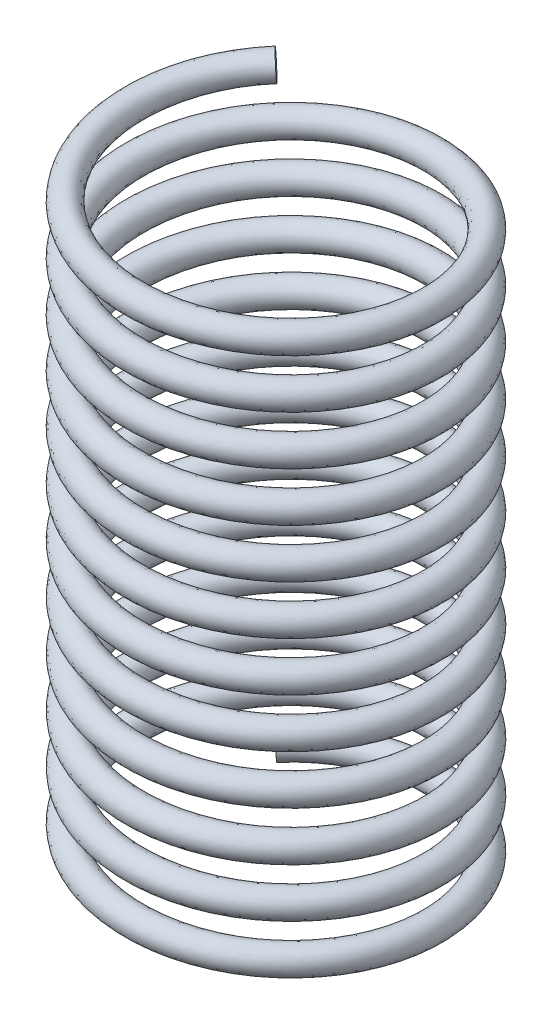
from build123d import *

# Parameters (mm, degrees)
SWEEP2_PITCH       = 1.1
SWEEP2_HEIGHT      = 13.2
SWEEP2_RADIUS      = 3.35
SWEEP2_START_ANGLE = -135
SWEEP2_PROFILE_R   = 0.3


with BuildPart() as part:
    # Sweep2: sweep along a helix
    with BuildLine() as sweep2_path:
        add(Helix(SWEEP2_PITCH, SWEEP2_HEIGHT, SWEEP2_RADIUS, center=(0, 0, 0), direction=(0, 1, 0), lefthand=True, mode=Mode.PRIVATE).rotate(Axis((0, 0, 0), (0, 1, 0)), SWEEP2_START_ANGLE))
    # Sweep2 profile (on start of the path) → Sweep2 (sweep)
    with BuildSketch(Plane(origin=(-2.368807717, 0, -2.368807717), x_dir=(-0.707106781186963, 0, -0.707106781186132), z_dir=(0.7061431683764361, 0.05218861474885663, -0.7061431683772659))):
        Circle(SWEEP2_PROFILE_R)
    sweep(path=sweep2_path.line, is_frenet=True)


solid = part.part
